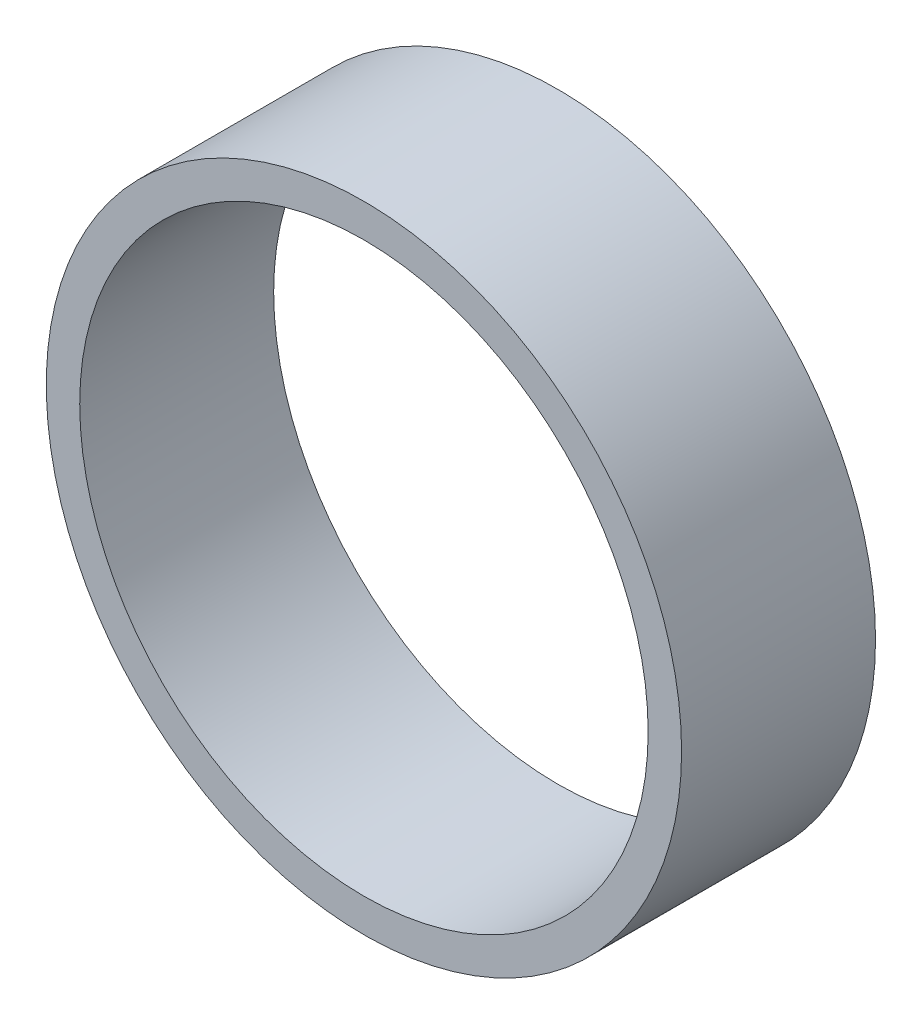
from build123d import *

# Parameters (mm, degrees)
SKETCH1_R           = 9.5
BOSS_EXTRUDE1_DEPTH = 5.8
SKETCH2_R           = 8.5
CUT_EXTRUDE1_DEPTH  = 5.8


with BuildPart() as part:
    # Sketch1 → Boss-Extrude1 (new body)
    with BuildSketch(Plane.XY):
        with Locations((-43.212664647, 1.441865661)):
            Circle(SKETCH1_R)
    extrude(amount=BOSS_EXTRUDE1_DEPTH)

    # Sketch2 → Cut-Extrude1 (cut)
    with BuildSketch(Plane.XY.offset(5.8)):
        with Locations((-43.212664647, 1.441865661)):
            Circle(SKETCH2_R)
    extrude(amount=-CUT_EXTRUDE1_DEPTH, mode=Mode.SUBTRACT)


solid = part.part
